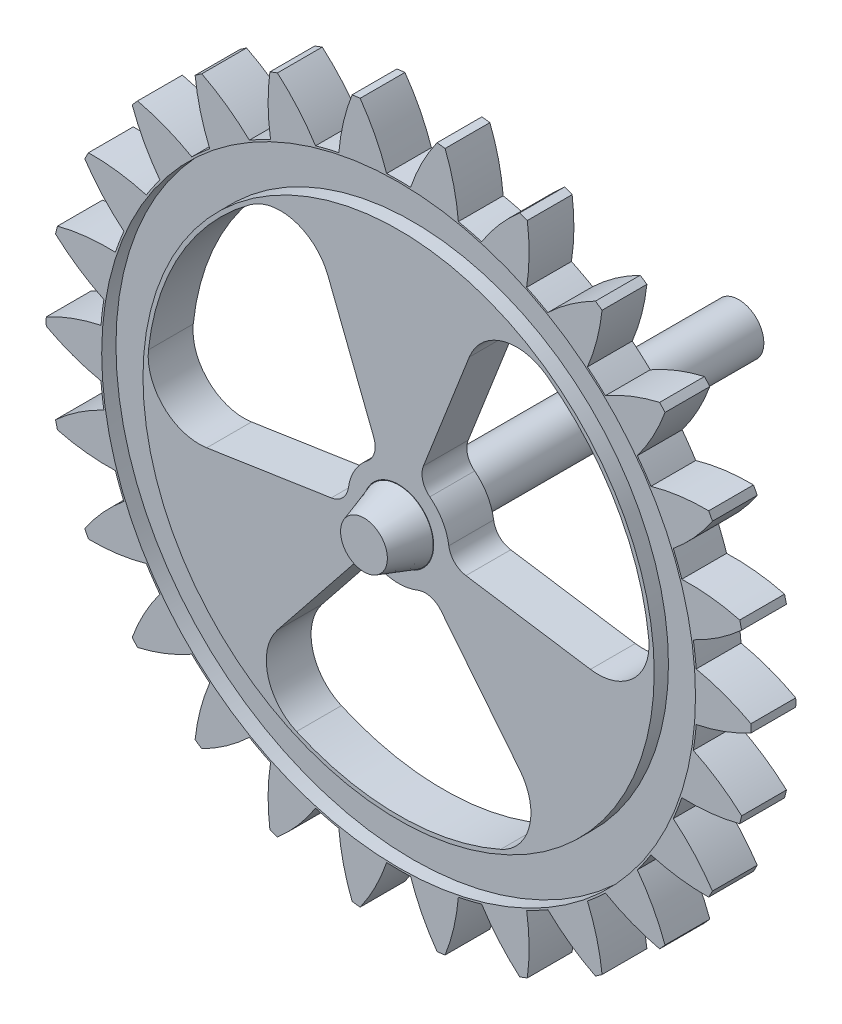
from build123d import *

# Parameters (mm, degrees)
ESQUISSE1_R                  = 3.459694908
ESQUISSE1_R_2                = 0.344660061
BOSS_EXTRU_1_DEPTH           = 0.44
ENL_V_MAT_EXTRU_1_DEPTH      = 0.44
R_P_TITION_CIRCULAIRE1_COUNT = 26
ENL_V_MAT_EXTRU_2_DEPTH      = 0.44
ESQUISSE4_R                  = 2.915204312
ESQUISSE4_R_2                = 2.509848562
ENL_V_MAT_EXTRU_3_DEPTH      = 0.14
ESQUISSE5_R                  = 2.834268586
ESQUISSE5_R_2                = 2.54862978
ENL_V_MAT_EXTRU_4_DEPTH      = 0.14
ESQUISSE6_R                  = 0.340242731
BOSS_EXTRU_2_DEPTH           = 0.34
BOSS_EXTRU_2_TAPER           = 18
ESQUISSE7_R                  = 0.246428111
BOSS_EXTRU_3_DEPTH           = 3.34


with BuildPart() as part:
    # Esquisse1 → Boss.-Extru.1 (new body)
    with BuildSketch(Plane.XY):
        Circle(ESQUISSE1_R)
        Circle(ESQUISSE1_R_2, mode=Mode.SUBTRACT)
    extrude(amount=BOSS_EXTRU_1_DEPTH)

    # Esquisse2 → Enlèv. mat.-Extru.1 (cut)
    with BuildSketch(Plane.XY.offset(0.44)):
        with BuildLine():
            ThreePointArc((0.474771031, 3.565047115), (0, 3.596521718), (-0.474771031, 3.565047115))
            ThreePointArc((-0.474771031, 3.565047115), (-0.266731611, 3.263756658), (-0.117781731, 2.92928652))
            ThreePointArc((-0.117781731, 2.92928652), (0, 2.931653467), (0.117781731, 2.92928652))
            ThreePointArc((0.117781731, 2.92928652), (0.266731611, 3.263756658), (0.474771031, 3.565047115))
        make_face()
    enl_v_mat_extru_1 = extrude(amount=-ENL_V_MAT_EXTRU_1_DEPTH, mode=Mode.SUBTRACT)

    # Répétition circulaire1: Enlèv. mat.-Extru.1 ×26 about axis
    r_p_tition_circulaire1_axis = Axis((0, 0, 0), (0, 0, 1))
    for i in range(1, R_P_TITION_CIRCULAIRE1_COUNT):
        add(enl_v_mat_extru_1.rotate(r_p_tition_circulaire1_axis, i * 360 / R_P_TITION_CIRCULAIRE1_COUNT), mode=Mode.SUBTRACT)

    # Esquisse3 → Enlèv. mat.-Extru.2 (cut)
    with BuildSketch(Plane.XY.offset(0.44)):
        with BuildLine():
            Line((0.694107626, 1.774534496), (0.243561407, 0.622681702))
            ThreePointArc((0.243561407, 0.622681702), (0.236917986, 0.497016855), (0.306643364, 0.392259228))
            ThreePointArc((0.306643364, 0.392259228), (0.431188, 0.248946508), (0.493028138, 0.069431329))
            ThreePointArc((0.493028138, 0.069431329), (0.548888216, -0.043331433), (0.661038876, -0.100410486))
            Line((0.661038876, -0.100410486), (1.883845766, -0.286152411))
            ThreePointArc((1.883845766, -0.286152411), (2.304466153, -0.153218847), (2.456133783, 0.261015113))
            ThreePointArc((2.456133783, 0.261015113), (2.139051551, 1.234981989), (1.45411261, 1.996566695))
            ThreePointArc((1.45411261, 1.996566695), (1.019541663, 2.072335654), (0.694107626, 1.774534496))
        make_face()
        with BuildLine():
            Line((-0.694107626, 1.774534496), (-0.243561407, 0.622681702))
            ThreePointArc((-0.243561407, 0.622681702), (-0.236917986, 0.497016855), (-0.306643364, 0.392259228))
            ThreePointArc((-0.306643364, 0.392259228), (-0.431188, 0.248946508), (-0.493028138, 0.069431329))
            ThreePointArc((-0.493028138, 0.069431329), (-0.548888216, -0.043331433), (-0.661038876, -0.100410486))
            Line((-0.661038876, -0.100410486), (-1.883845766, -0.286152411))
            ThreePointArc((-1.883845766, -0.286152411), (-2.304466153, -0.153218847), (-2.456133783, 0.261015113))
            ThreePointArc((-2.456133783, 0.261015113), (-2.139051551, 1.234981989), (-1.45411261, 1.996566695))
            ThreePointArc((-1.45411261, 1.996566695), (-1.019541663, 2.072335654), (-0.694107626, 1.774534496))
        make_face()
        with BuildLine():
            Line((1.18973814, -1.488382084), (0.417477469, -0.522271216))
            ThreePointArc((0.417477469, -0.522271216), (0.31197023, -0.453685422), (0.186384774, -0.461690557))
            ThreePointArc((0.186384774, -0.461690557), (0, -0.497893015), (-0.186384774, -0.461690557))
            ThreePointArc((-0.186384774, -0.461690557), (-0.31197023, -0.453685422), (-0.417477469, -0.522271216))
            Line((-0.417477469, -0.522271216), (-1.18973814, -1.488382084))
            ThreePointArc((-1.18973814, -1.488382084), (-1.28492449, -1.919116808), (-1.002021173, -2.257581808))
            ThreePointArc((-1.002021173, -2.257581808), (0, -2.469963977), (1.002021173, -2.257581808))
            ThreePointArc((1.002021173, -2.257581808), (1.28492449, -1.919116808), (1.18973814, -1.488382084))
        make_face()
    extrude(amount=-ENL_V_MAT_EXTRU_2_DEPTH, mode=Mode.SUBTRACT)

    # Esquisse4 → Enlèv. mat.-Extru.3 (cut)
    with BuildSketch(Plane.XY.offset(0.44)):
        Circle(ESQUISSE4_R)
        Circle(ESQUISSE4_R_2, mode=Mode.SUBTRACT)
    extrude(amount=-ENL_V_MAT_EXTRU_3_DEPTH, mode=Mode.SUBTRACT)

    # Esquisse5 → Enlèv. mat.-Extru.4 (cut)
    with BuildSketch(Plane(origin=(0, 0, 0), x_dir=(-1, 0, 0), z_dir=(0, 0, -1))):
        Circle(ESQUISSE5_R)
        Circle(ESQUISSE5_R_2, mode=Mode.SUBTRACT)
    extrude(amount=-ENL_V_MAT_EXTRU_4_DEPTH, mode=Mode.SUBTRACT)


with BuildPart() as body_2:
    # Esquisse6 → Boss.-Extru.2 (new body)
    with BuildSketch(Plane.XY.offset(0.44)):
        Circle(ESQUISSE6_R)
    extrude(amount=BOSS_EXTRU_2_DEPTH, taper=BOSS_EXTRU_2_TAPER)

    # Esquisse7 → Boss.-Extru.3 (add)
    with BuildSketch(Plane(origin=(0, 0, 0.44), x_dir=(-1, 0, 0), z_dir=(0, 0, -1))):
        with Locations(Location((0, 0, 0), (0, 0, 180))):
            Circle(ESQUISSE7_R)
    extrude(amount=BOSS_EXTRU_3_DEPTH)


solid = Compound([part.part, body_2.part])
